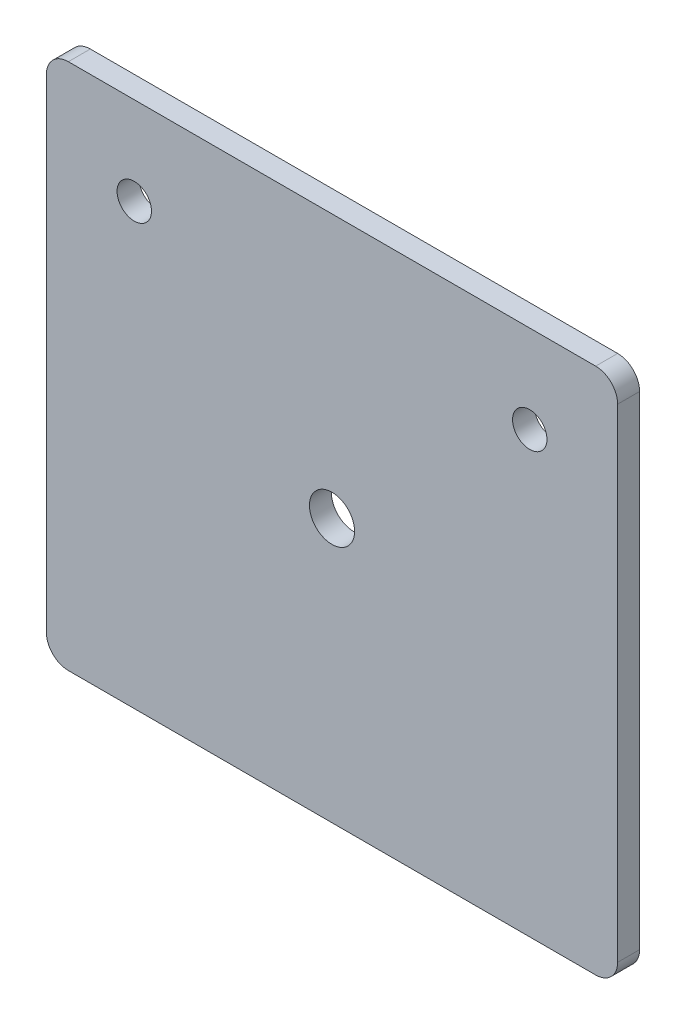
from build123d import *

# Parameters (mm, degrees)
SKETCH1_W               = 82.55
SKETCH1_H               = 76.2
SKETCH1_R               = 3.175
BOSS_EXTRUDE1_DEPTH     = 3.175
F_10_CLEARANCE_HOLE1_D  = 4.9784
F_1_4_CLEARANCE_HOLE1_D = 6.5278
FILLET2_R               = 3.175


with BuildPart() as part:
    # Sketch1 → Boss-Extrude1 (new body)
    # profile 1 of 4: a face of its own
    with BuildSketch(Plane.XY):
        Rectangle(SKETCH1_W, SKETCH1_H)
        Circle(SKETCH1_R, mode=Mode.SUBTRACT)
        with Locations((28.575, 25.4)):
            Circle(SKETCH1_R, mode=Mode.SUBTRACT)
        with Locations((-28.575, 25.4)):
            Circle(SKETCH1_R, mode=Mode.SUBTRACT)
    # profile 2 of 4: a face of its own
    with BuildSketch(Plane.XY):
        with Locations((-28.575, 25.4)):
            Circle(SKETCH1_R)
    # profile 3 of 4: a face of its own
    with BuildSketch(Plane.XY):
        Circle(SKETCH1_R)
    # profile 4 of 4: a face of its own
    with BuildSketch(Plane.XY):
        with Locations((28.575, 25.4)):
            Circle(SKETCH1_R)
    extrude(amount=BOSS_EXTRUDE1_DEPTH)

    # #10 Clearance Hole1 (through all)
    with Locations(Plane.XY.offset(3.175)):
        with Locations((-28.575, 25.4), (28.575, 25.4)):
            Hole(F_10_CLEARANCE_HOLE1_D / 2)

    # 1/4 Clearance Hole1 (through all)
    with Locations(Plane.XY.offset(3.175)):
        with Locations((0, 0)):
            Hole(F_1_4_CLEARANCE_HOLE1_D / 2)

    # Fillet2
    fillet2_edges = [part.edges().sort_by_distance(p)[0] for p in [
        (-41.275, -38.1, 1.5875),
        (-41.275, 38.1, 1.5875),
        (41.275, 38.1, 1.5875),
        (41.275, -38.1, 1.5875),
    ]]
    fillet(fillet2_edges, radius=FILLET2_R)


solid = part.part
